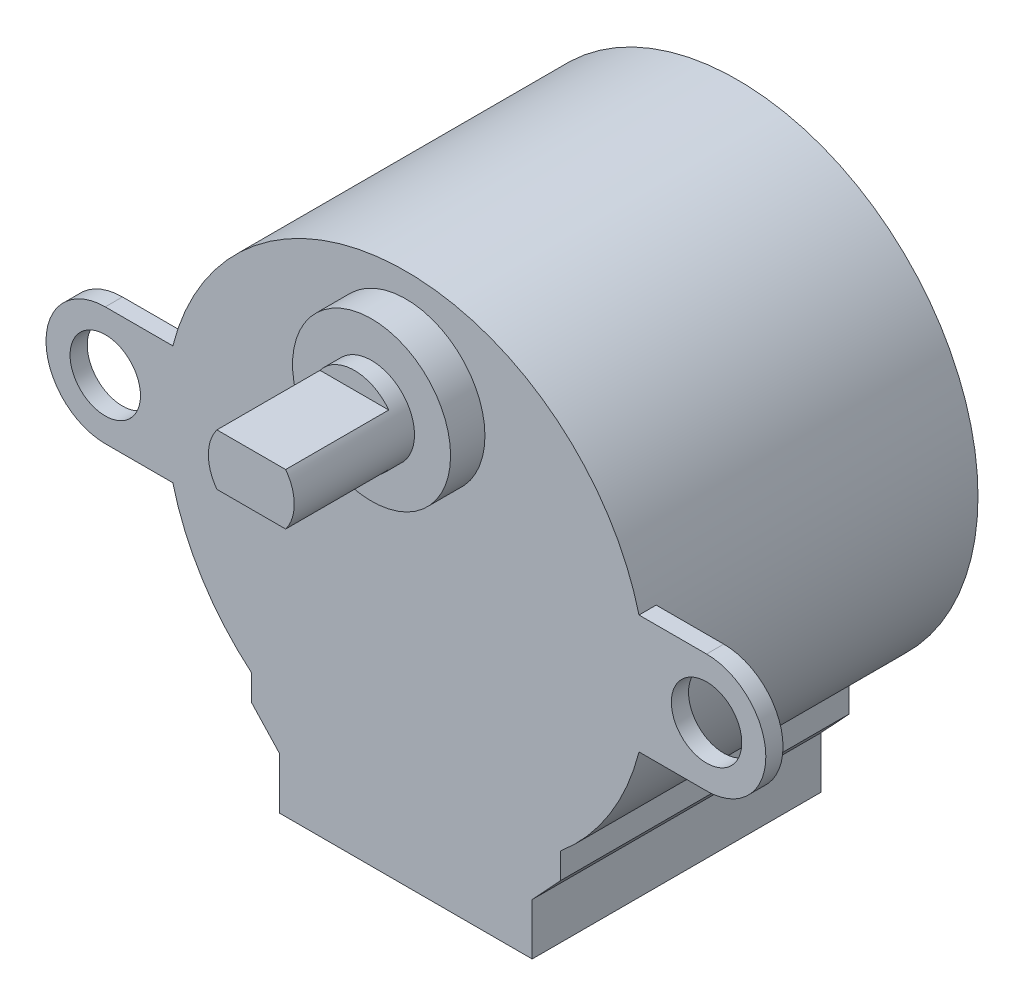
from build123d import *

# Parameters (mm, degrees)
SKETCH1_R           = 14
BOSS_EXTRUDE1_DEPTH = 19.3
BOSS_EXTRUDE2_START = -16.8
BOSS_EXTRUDE2_DEPTH = 16.8
CUT_EXTRUDE1_DEPTH  = 2
BOSS_EXTRUDE3_START = -1
SKETCH5_R           = 2.05
BOSS_EXTRUDE3_DEPTH = 1
SKETCH6_R           = 4.6
BOSS_EXTRUDE4_DEPTH = 2
SKETCH7_R           = 2.5
BOSS_EXTRUDE5_DEPTH = 7
CUT_EXTRUDE2_START  = -6
CUT_EXTRUDE2_DEPTH  = 6


with BuildPart() as part:
    # Sketch1 → Boss-Extrude1 (new body)
    with BuildSketch(Plane.XY):
        Circle(SKETCH1_R)
    extrude(amount=BOSS_EXTRUDE1_DEPTH)

    # Sketch2 → Boss-Extrude2 (add)
    with BuildSketch(Plane.XY.offset(19.3).offset(BOSS_EXTRUDE2_START)):
        with BuildLine():
            Line((-7.35, -17), (7.35, -17))
            Line((7.35, -17), (7.35, -14))
            Line((7.35, -14), (9, -12.223805295))
            Line((9, -12.223805295), (9, -10.723805295))
            ThreePointArc((9, -10.723805295), (0, -14), (-9, -10.723805295))
            Line((-9, -10.723805295), (-9, -12.223805295))
            Line((-9, -12.223805295), (-7.35, -14))
            Line((-7.35, -14), (-7.35, -17))
        make_face()
    extrude(amount=BOSS_EXTRUDE2_DEPTH)

    # Sketch4 → Cut-Extrude1 (cut)
    with BuildSketch(Plane.XZ.offset(17)):
        with BuildLine():
            Line((-3, 18.05), (3, 18.05))
            ThreePointArc((3, 18.05), (3.5, 17.55), (3, 17.05))
            Line((3, 17.05), (-3, 17.05))
            ThreePointArc((-3, 17.05), (-3.5, 17.55), (-3, 18.05))
        make_face()
    extrude(amount=-CUT_EXTRUDE1_DEPTH, mode=Mode.SUBTRACT)

    # Sketch5 → Boss-Extrude3 (add)
    # profile 1 of 2: a face of its own
    with BuildSketch(Plane.XY.offset(19.3).offset(BOSS_EXTRUDE3_START)):
        with BuildLine():
            Line((-17.5, 3.45), (-13.568253388, 3.45))
            ThreePointArc((-13.568253388, 3.45), (-14, 0), (-13.568253388, -3.45))
            Line((-13.568253388, -3.45), (-17.5, -3.45))
            ThreePointArc((-17.5, -3.45), (-20.95, 0), (-17.5, 3.45))
        make_face()
        with Locations((-17.5, 0)):
            Circle(SKETCH5_R, mode=Mode.SUBTRACT)
    # profile 2 of 2: a face of its own
    with BuildSketch(Plane.XY.offset(19.3).offset(BOSS_EXTRUDE3_START)):
        with BuildLine():
            Line((17.5, -3.45), (13.568253388, -3.45))
            ThreePointArc((13.568253388, -3.45), (14, 0), (13.568253388, 3.45))
            Line((13.568253388, 3.45), (17.5, 3.45))
            ThreePointArc((17.5, 3.45), (20.95, 0), (17.5, -3.45))
        make_face()
        with Locations(Location((17.5, 0, 0), (0, 0, 180))):
            Circle(SKETCH5_R, mode=Mode.SUBTRACT)
    extrude(amount=BOSS_EXTRUDE3_DEPTH)

    # Sketch6 → Boss-Extrude4 (add)
    with BuildSketch(Plane.XY.offset(19.3)):
        with Locations((0, 8)):
            Circle(SKETCH6_R)
    extrude(amount=BOSS_EXTRUDE4_DEPTH)

    # Sketch7 → Boss-Extrude5 (add)
    with BuildSketch(Plane.XY.offset(21.3)):
        with Locations((0, 8)):
            Circle(SKETCH7_R)
    extrude(amount=BOSS_EXTRUDE5_DEPTH)

    # Sketch8 → Cut-Extrude2 (cut)
    with BuildSketch(Plane.XY.offset(28.3).offset(CUT_EXTRUDE2_START)):
        with BuildLine():
            ThreePointArc((2, 9.5), (0, 10.5), (-2, 9.5))
            Line((-2, 9.5), (2, 9.5))
        make_face()
        with BuildLine():
            Line((2, 6.5), (-2, 6.5))
            ThreePointArc((-2, 6.5), (0, 5.5), (2, 6.5))
        make_face()
    extrude(amount=CUT_EXTRUDE2_DEPTH, mode=Mode.SUBTRACT)


solid = part.part
